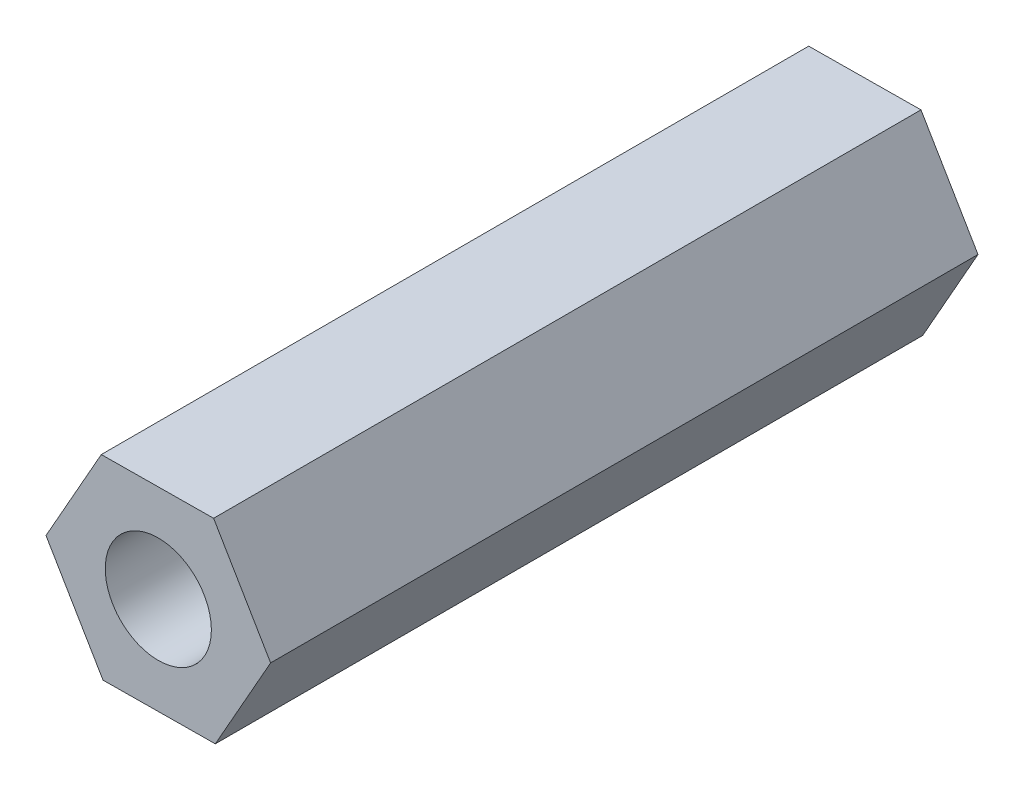
from build123d import *

# Parameters (mm, degrees)
SKETCH_1_R      = 1.5
EXTRUDE_1_DEPTH = 20


with BuildPart() as part:
    # 草图1 → 凸台-拉伸1 (new body)
    with BuildSketch(Plane.XY):
        Polygon((1.61185848, -2.735917684), (3.175303457, 0.027951549), (1.563444977, 2.763869233), (-1.61185848, 2.735917684), (-3.175303457, -0.027951549), (-1.563444977, -2.763869233), align=None)
        Circle(SKETCH_1_R, mode=Mode.SUBTRACT)
    extrude(amount=EXTRUDE_1_DEPTH)


solid = part.part
